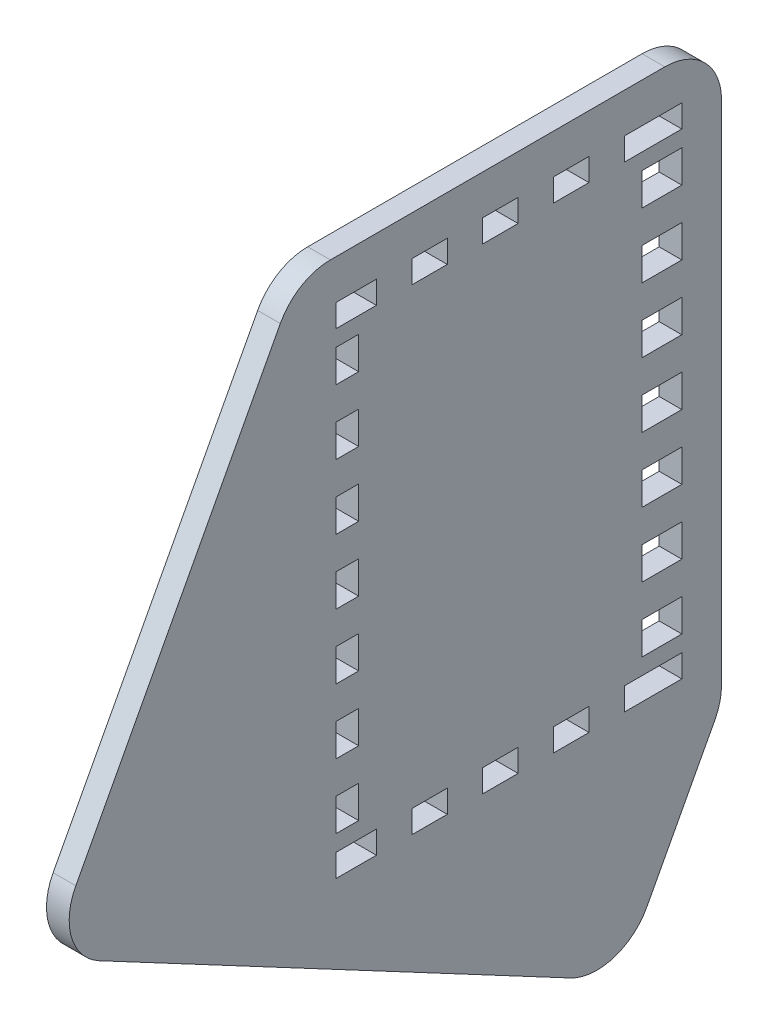
from build123d import *

# Parameters (mm, degrees)
SCHIZZO1_W                   = 50
SCHIZZO1_H                   = 80
ESTRUSIONE_ESTRUSIONE1_DEPTH = 4
SCHIZZO2_W                   = 4
SCHIZZO2_H                   = 2.857142857
SCHIZZO2_W_2                 = 7
ESTRUSIONE_ESTRUSIONE2_DEPTH = 4
SCHIZZO3_W                   = 4
SCHIZZO3_H                   = 5.714285715
SCHIZZO3_W_2                 = 7
ESTRUSIONE_ESTRUSIONE3_DEPTH = 4
RIPETIZIONE_A_L1_COUNT       = 6
RIPETIZIONE_A_L1_PITCH       = 11.428571
SCHIZZO4_W                   = 6.25
SCHIZZO4_H                   = 4
ESTRUSIONE_ESTRUSIONE4_DEPTH = 4
RIPETIZIONE_A_L2_COUNT       = 4
RIPETIZIONE_A_L2_PITCH       = 12.5
SCHIZZO5_W                   = 61
SCHIZZO5_H                   = 88
ESTRUSIONE_ESTRUSIONE5_DEPTH = 4
RACCORDO1_R                  = 10
RACCORDO2_R                  = 10


with BuildPart() as part:
    # Schizzo1 → Estrusione-Estrusione1 (new body)
    with BuildSketch(Plane(origin=(0, 0, 0), x_dir=(0, 0, -1), z_dir=(1, 0, 0))):
        with Locations((25, 40)):
            Rectangle(SCHIZZO1_W, SCHIZZO1_H)
    extrude(amount=ESTRUSIONE_ESTRUSIONE1_DEPTH)

    # Schizzo2 → Estrusione-Estrusione2 (add)
    with BuildSketch(Plane(origin=(4, 0, 0), x_dir=(0, 0, -1), z_dir=(1, 0, 0))):
        with Locations((-2, 78.571428572)):
            Rectangle(SCHIZZO2_W, SCHIZZO2_H)
        with Locations((53.5, 78.571428572)):
            Rectangle(SCHIZZO2_W_2, SCHIZZO2_H)
        with Locations((53.5, 1.428571429)):
            Rectangle(SCHIZZO2_W_2, SCHIZZO2_H)
        with Locations((-2, 1.428571429)):
            Rectangle(SCHIZZO2_W, SCHIZZO2_H)
    extrude(amount=-ESTRUSIONE_ESTRUSIONE2_DEPTH)

    # Schizzo3 → Estrusione-Estrusione3 (add)
    with BuildSketch(Plane(origin=(4, 0, 0), x_dir=(0, 0, -1), z_dir=(1, 0, 0))):
        with Locations((-2, 68.571428572)):
            Rectangle(SCHIZZO3_W, SCHIZZO3_H)
        with Locations((53.5, 68.571428572)):
            Rectangle(SCHIZZO3_W_2, SCHIZZO3_H)
    estrusione_estrusione3 = extrude(amount=-ESTRUSIONE_ESTRUSIONE3_DEPTH)

    # Ripetizione a L1: Estrusione-Estrusione3 ×6
    with Locations(*[(0, -i * RIPETIZIONE_A_L1_PITCH, 0) for i in range(1, RIPETIZIONE_A_L1_COUNT)]):
        add(estrusione_estrusione3)

    # Schizzo4 → Estrusione-Estrusione4 (add)
    with BuildSketch(Plane(origin=(4, 0, 0), x_dir=(0, 0, -1), z_dir=(1, 0, 0))):
        with Locations((6.25, 82)):
            Rectangle(SCHIZZO4_W, SCHIZZO4_H)
        with Locations((6.25, -2)):
            Rectangle(SCHIZZO4_W, SCHIZZO4_H)
    estrusione_estrusione4 = extrude(amount=-ESTRUSIONE_ESTRUSIONE4_DEPTH)

    # Ripetizione a L2: Estrusione-Estrusione4 ×4
    with Locations(*[(0, 0, -i * RIPETIZIONE_A_L2_PITCH) for i in range(1, RIPETIZIONE_A_L2_COUNT)]):
        add(estrusione_estrusione4)

    # Schizzo5 → Estrusione-Estrusione5 (add)
    with BuildSketch(Plane(origin=(4, 0, 0), x_dir=(0, 0, -1), z_dir=(1, 0, 0))):
        Polygon((64, -11), (46.160080614, -44.552008529), (-54.590569466, 9.018062365), (-11, 91), (64, 91), align=None)
        with Locations((26.5, 40)):
            Rectangle(SCHIZZO5_W, SCHIZZO5_H, mode=Mode.SUBTRACT)
    extrude(amount=-ESTRUSIONE_ESTRUSIONE5_DEPTH)

    # Raccordo1
    raccordo1_edges = [part.edges().sort_by_distance(p)[0] for p in [
        (2, -44.552008529, -46.160080614),
        (2, 9.018062365, 54.590569466),
    ]]
    fillet(raccordo1_edges, radius=RACCORDO1_R)

    # Raccordo2
    raccordo2_edges = [part.edges().sort_by_distance(p)[0] for p in [
        (2, 91, -64),
        (2, -11, -64),
        (2, 91, 11),
    ]]
    fillet(raccordo2_edges, radius=RACCORDO2_R)


solid = part.part
